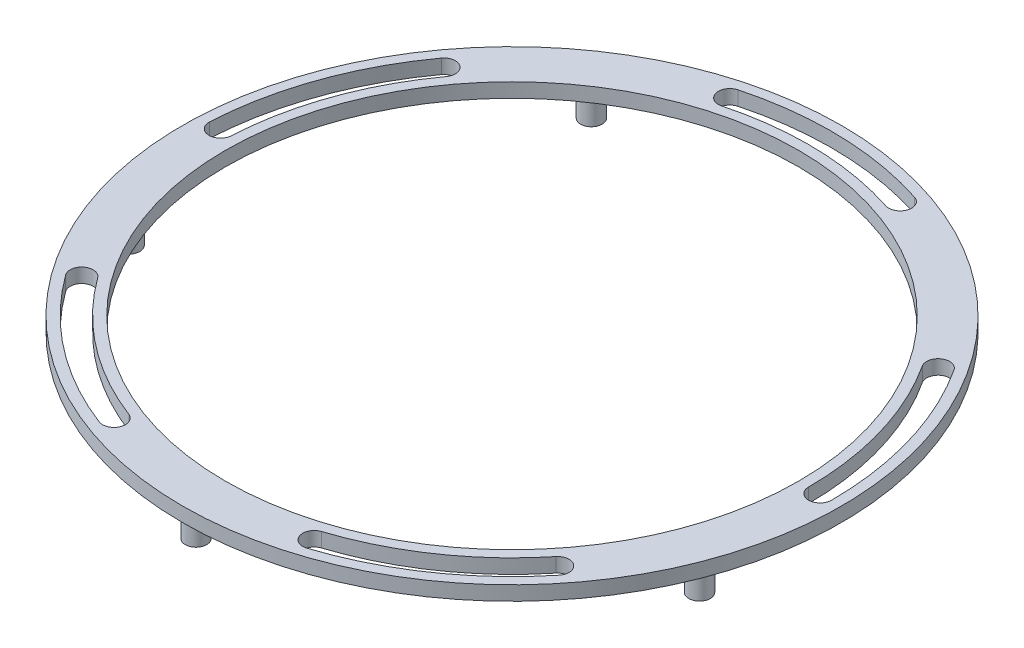
from build123d import *

# Parameters (mm, degrees)
SKETCH1_R           = 46
SKETCH1_R_2         = 40
BOSS_EXTRUDE1_DEPTH = 2
CUT_EXTRUDE1_REACH  = 67.085
SKETCH2_R           = 1.5
SKETCH3_R           = 1.5
BOSS_EXTRUDE2_DEPTH = 6
CIRPATTERN1_COUNT   = 5


with BuildPart() as part:
    # Sketch1 → Boss-Extrude1 (new body)
    with BuildSketch(Plane(origin=(0, 0, 0), x_dir=(1, 0, 0), z_dir=(0, 1, 0))):
        with Locations(Location((0, 0, 0), (0, 0, 270))):
            Circle(SKETCH1_R)
        with Locations(Location((0, 0, 0), (0, 0, 270))):
            Circle(SKETCH1_R_2, mode=Mode.SUBTRACT)
    extrude(amount=BOSS_EXTRUDE1_DEPTH)

    # Sketch2 → Cut-Extrude1 (cut, up to next)
    with BuildSketch(Plane(origin=(0, 2, 0), x_dir=(1, 0, 0), z_dir=(0, 1, 0)), mode=Mode.PRIVATE) as cut_extrude1_sk1:
        with Locations(Location((26.176741447, 34.114193633, 0), (0, 0, 270))):
            Circle(SKETCH2_R)
    cut_extrude1_tool1 = extrude(cut_extrude1_sk1.sketch, amount=-CUT_EXTRUDE1_REACH, mode=Mode.PRIVATE) & part.part
    # Sketch2 → Cut-Extrude1 (cut, up to next)
    with BuildSketch(Plane(origin=(0, 2, 0), x_dir=(1, 0, 0), z_dir=(0, 1, 0)), mode=Mode.PRIVATE) as cut_extrude1_sk2:
        with BuildLine():
            ThreePointArc((44.6, 0), (42.763360175, 12.667084374), (37.40470733, 24.290900962))
            ThreePointArc((37.40470733, 24.290900962), (35.191411966, 24.761351414), (34.720961513, 22.54805605))
            ThreePointArc((34.720961513, 22.54805605), (39.695137024, 11.758235271), (41.4, 0))
            ThreePointArc((41.4, 0), (43, -1.6), (44.6, 0))
        make_face()
    cut_extrude1_tool2 = extrude(cut_extrude1_sk2.sketch, amount=-CUT_EXTRUDE1_REACH, mode=Mode.PRIVATE) & part.part
    cut_extrude1_1 = cut_extrude1_tool1.solids().sort_by_distance((26.176741, 2, -34.114194))[0]
    add(cut_extrude1_1, mode=Mode.SUBTRACT)
    cut_extrude1_2 = cut_extrude1_tool2.solids().sort_by_distance((40.557599, 2, -12.013708))[0]
    add(cut_extrude1_2, mode=Mode.SUBTRACT)
    cut_extrude1 = cut_extrude1_1 + cut_extrude1_2  # Cut-Extrude1 as one shape, for the pattern or mirror that repeats it

    # Sketch3 → Boss-Extrude2 (add)
    with BuildSketch(Plane(origin=(0, 2, 0), x_dir=(1, 0, 0), z_dir=(0, 1, 0))):
        with Locations(Location((26.176741447, 34.114193633, 0), (0, 0, 270))):
            Circle(SKETCH3_R)
    boss_extrude2 = extrude(amount=-BOSS_EXTRUDE2_DEPTH)

    # CirPattern1: Cut-Extrude1, Boss-Extrude2 ×5 about axis
    cirpattern1_axis = Axis((0, 0, 0), (0, 1, 0))
    add([cut_extrude1.rotate(cirpattern1_axis, i * 360 / CIRPATTERN1_COUNT) for i in range(1, CIRPATTERN1_COUNT)], mode=Mode.SUBTRACT)
    add([boss_extrude2.rotate(cirpattern1_axis, i * 360 / CIRPATTERN1_COUNT) for i in range(1, CIRPATTERN1_COUNT)])


solid = part.part
